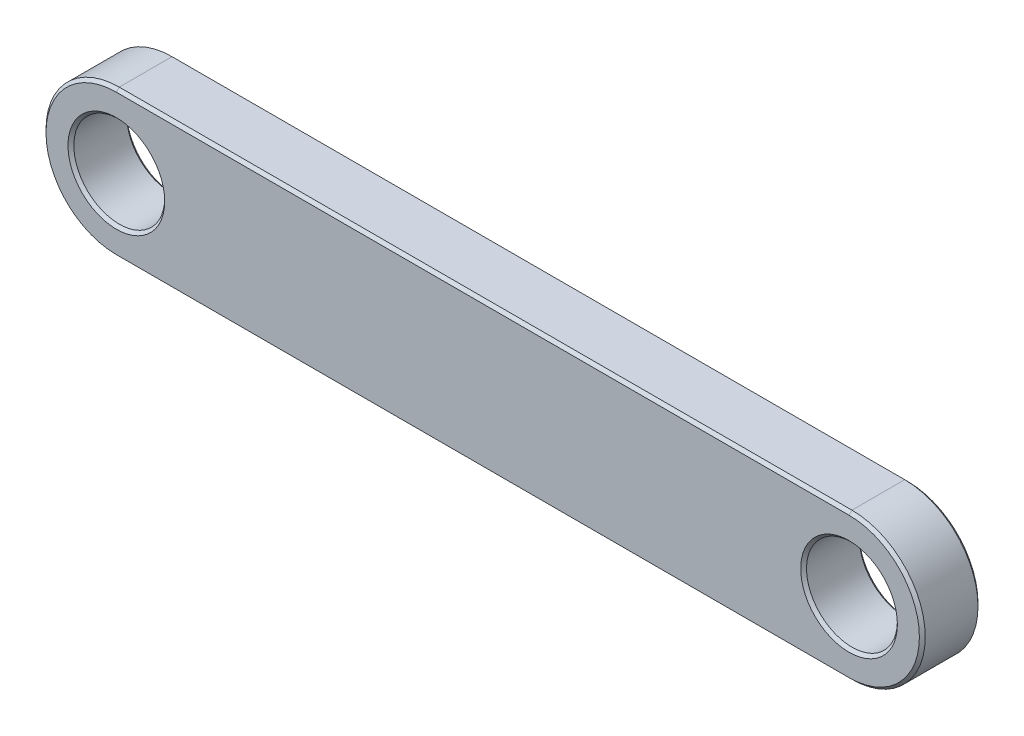
from build123d import *

# Parameters (mm, degrees)
SKETCH1_R           = 1.55
BOSS_EXTRUDE1_DEPTH = 2
CHAMFER1_SIZE       = 0.1


with BuildPart() as part:
    # Sketch1 → Boss-Extrude1 (new body)
    with BuildSketch(Plane.XY):
        with BuildLine():
            Line((-12.5, 2.5), (12.5, 2.5))
            ThreePointArc((12.5, 2.5), (15, 0), (12.5, -2.5))
            Line((12.5, -2.5), (-12.5, -2.5))
            ThreePointArc((-12.5, -2.5), (-15, 0), (-12.5, 2.5))
        make_face()
        with Locations((-12.5, 0)):
            Circle(SKETCH1_R, mode=Mode.SUBTRACT)
        with Locations((12.5, 0)):
            Circle(SKETCH1_R, mode=Mode.SUBTRACT)
    extrude(amount=BOSS_EXTRUDE1_DEPTH)

    # Chamfer1
    chamfer1_edges = [part.edges().sort_by_distance(p)[0] for p in [
        (-14.05, 0, 0),
        (-14.05, 0, 2),
        (15, 0, 2),
        (10.95, 0, 0),
        (10.95, 0, 2),
        (0, 2.5, 2),
        (-15, 0, 2),
        (0, 2.5, 0),
        (15, 0, 0),
        (0, -2.5, 0),
        (-15, 0, 0),
        (0, -2.5, 2),
    ]]
    chamfer(chamfer1_edges, length=CHAMFER1_SIZE)


solid = part.part
